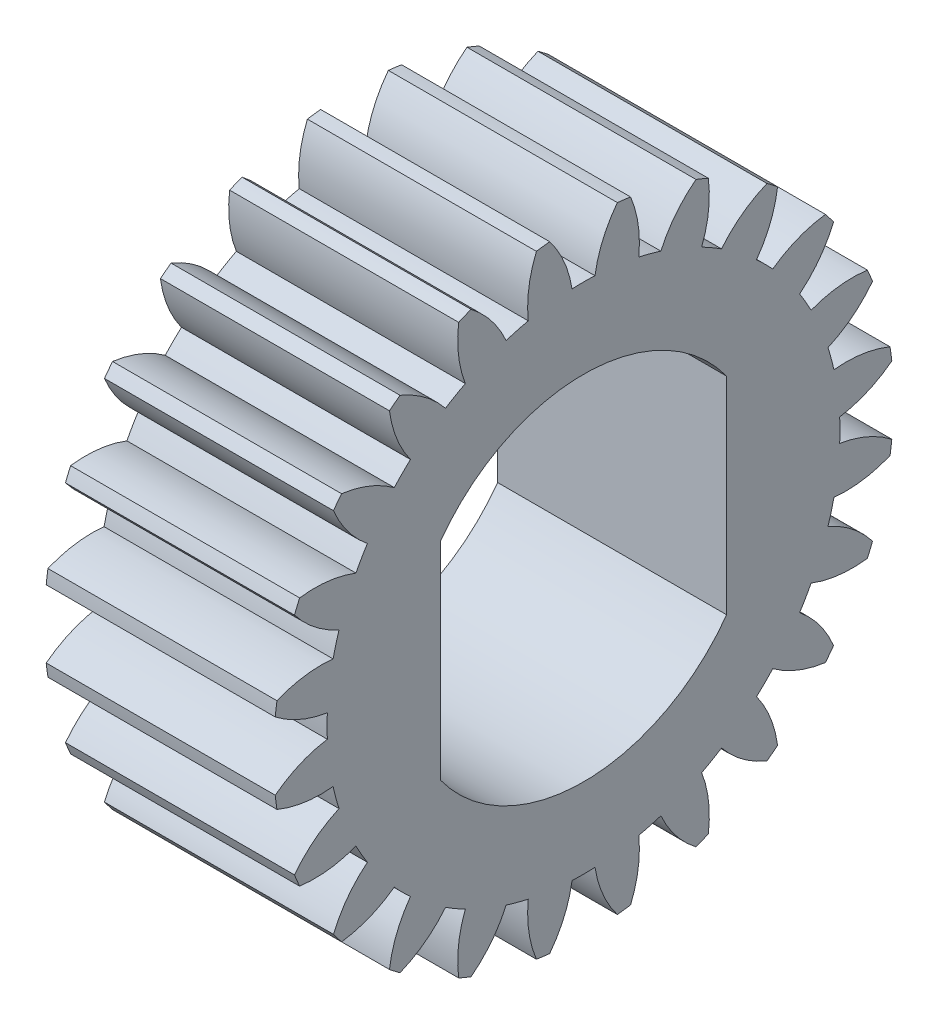
from build123d import *

# Parameters (mm, degrees)
BASPROSKE_W     = 12
BASPROSKE_H     = 16.25
TOOTHCUT_DEPTH  = 26.925373671
TEETHCUTS_COUNT = 24
TEETHCUTS_ANGLE = 345
BORSKE_R        = 12
BORE_DEPTH      = 50.0000508
SKETCH_1_R      = 12
SKETCH_1_R_2    = 9.25
EXTRUDE_1_DEPTH = 12
EXTRUDE_2_DEPTH = 12


with BuildPart() as part:
    # BasProSke → Base-Revolve (revolve)
    with BuildSketch(Plane(origin=(0, 0, 0), x_dir=(1, 0, 0), z_dir=(0, 1, 0)), mode=Mode.PRIVATE) as base_revolve_sk:
        with Locations((6, 8.125)):
            Rectangle(BASPROSKE_W, BASPROSKE_H)
    revolve(base_revolve_sk.sketch.rotate(Axis((-10, 0, 0), (1, 0, 0)), 180), axis=Axis((-10, 0, 0), (1, 0, 0)))

    # TooCutSke → ToothCut (cut, through all)
    with BuildSketch(Plane(origin=(0, 0, 0), x_dir=(0, 0, -1), z_dir=(1, 0, 0))):
        with BuildLine():
            ThreePointArc((0.600427448, 13.423077856), (0, 13.4365), (-0.600427448, 13.423077856))
            ThreePointArc((-0.600427448, 13.423077856), (-1.021266982, 14.875437681), (-1.791844283, 16.176462507))
            ThreePointArc((-1.791844283, 16.176462507), (0, 16.2754), (1.791844283, 16.176462507))
            ThreePointArc((1.791844283, 16.176462507), (1.021266982, 14.875437681), (0.600427448, 13.423077856))
        make_face()
    toothcut = extrude(amount=TOOTHCUT_DEPTH, mode=Mode.SUBTRACT)

    # TeethCuts: ToothCut ×24 about axis
    teethcuts_axis = Axis((-10, 0, 0), (1, 0, 0))
    for i in range(1, TEETHCUTS_COUNT):
        add(toothcut.rotate(teethcuts_axis, i * TEETHCUTS_ANGLE / (TEETHCUTS_COUNT - 1)), mode=Mode.SUBTRACT)

    # BorSke → Bore (cut, symmetric)
    with BuildSketch(Plane(origin=(0, 0, 0), x_dir=(0, 0, -1), z_dir=(1, 0, 0))):
        with Locations(Location((0, 0, 0), (0, 0, 180))):
            Circle(BORSKE_R)
    extrude(amount=BORE_DEPTH, both=True, mode=Mode.SUBTRACT)

    # 草图1 → 凸台-拉伸1 (add, through all)
    with BuildSketch(Plane.ZY):
        Circle(SKETCH_1_R)
        Circle(SKETCH_1_R_2, mode=Mode.SUBTRACT)
    extrude(amount=-EXTRUDE_1_DEPTH)

    # 草图2 → 凸台-拉伸2 (add, through all)
    with BuildSketch(Plane.ZY):
        with BuildLine():
            Line((-7.5, 5.414101957), (-7.5, -5.414101957))
            ThreePointArc((-7.5, -5.414101957), (-9.25, 0), (-7.5, 5.414101957))
        make_face()
        with BuildLine():
            Line((7.5, 5.414101957), (7.5, -5.414101957))
            ThreePointArc((7.5, -5.414101957), (9.25, 0), (7.5, 5.414101957))
        make_face()
    extrude(amount=-EXTRUDE_2_DEPTH)


solid = part.part
